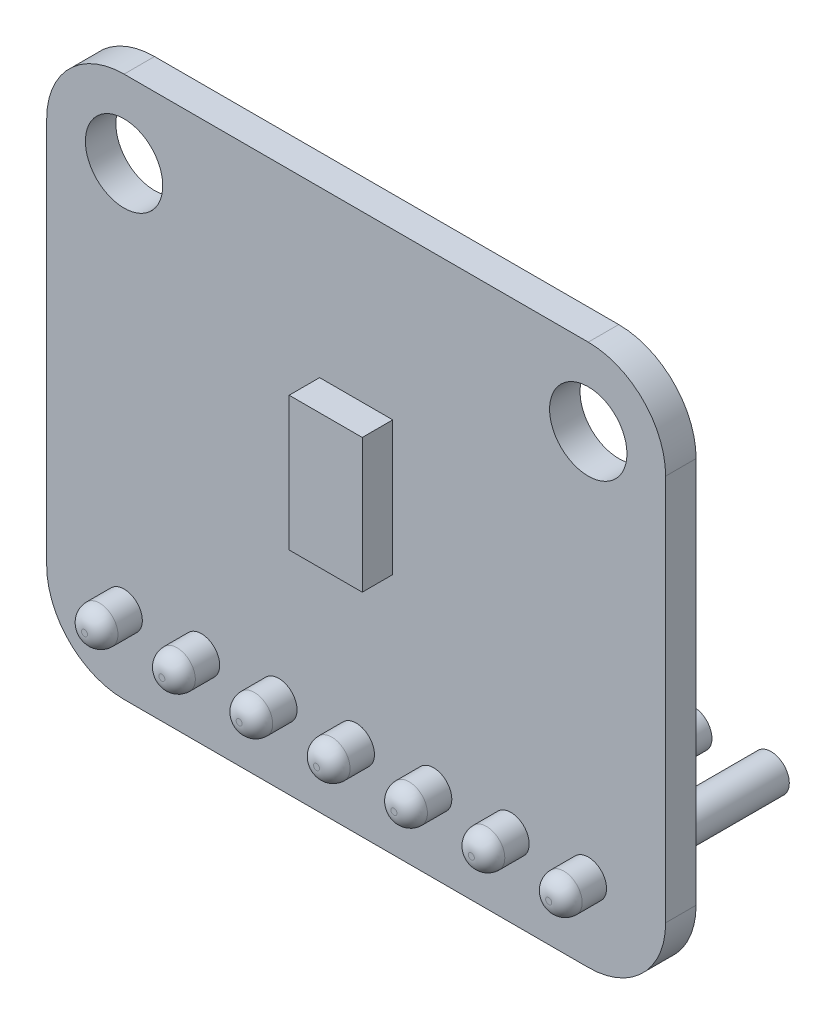
from build123d import *

# Parameters (mm, degrees)
SKETCH1_W           = 20.32
SKETCH1_H           = 17.78
BOSS_EXTRUDE1_DEPTH = 1
FILLET2_R           = 2.54
SKETCH2_R           = 1.27
CUT_EXTRUDE1_DEPTH  = 14.537270774
SKETCH3_W           = 2.4
SKETCH3_H           = 4.4
BOSS_EXTRUDE2_DEPTH = 1
SKETCH4_R           = 0.6
BOSS_EXTRUDE3_DEPTH = 1.3
BOSS_EXTRUDE4_START = -6
SKETCH4_2_R         = 0.6
BOSS_EXTRUDE4_DEPTH = 6
FILLET3_R           = 0.5


with BuildPart() as part:
    # Sketch1 → Boss-Extrude1 (new body)
    with BuildSketch(Plane.XY):
        Rectangle(SKETCH1_W, SKETCH1_H)
    extrude(amount=BOSS_EXTRUDE1_DEPTH)

    # Fillet2
    fillet2_edges = [part.edges().sort_by_distance(p)[0] for p in [
        (-10.16, -8.89, 0.5),
        (10.16, -8.89, 0.5),
        (10.16, 8.89, 0.5),
        (-10.16, 8.89, 0.5),
    ]]
    fillet(fillet2_edges, radius=FILLET2_R)

    # Sketch2 → Cut-Extrude1 (cut, through all)
    with BuildSketch(Plane.XY.offset(1)):
        with Locations((-7.62, 6.35)):
            Circle(SKETCH2_R)
        with Locations((7.62, 6.35)):
            Circle(SKETCH2_R)
    extrude(amount=-CUT_EXTRUDE1_DEPTH, mode=Mode.SUBTRACT)

    # Sketch3 → Boss-Extrude2 (add)
    with BuildSketch(Plane.XY.offset(1)):
        with Locations((0, 1.27)):
            Rectangle(SKETCH3_W, SKETCH3_H)
    extrude(amount=BOSS_EXTRUDE2_DEPTH)

    # Sketch4 → Boss-Extrude3 (add)
    with BuildSketch(Plane.XY.offset(1)):
        with Locations((-7.62, -6.35)):
            Circle(SKETCH4_R)
        with Locations((-5.08, -6.35)):
            Circle(SKETCH4_R)
        with Locations((-2.54, -6.35)):
            Circle(SKETCH4_R)
        with Locations((0, -6.35)):
            Circle(SKETCH4_R)
        with Locations((2.54, -6.35)):
            Circle(SKETCH4_R)
        with Locations((5.08, -6.35)):
            Circle(SKETCH4_R)
        with Locations((7.62, -6.35)):
            Circle(SKETCH4_R)
    extrude(amount=BOSS_EXTRUDE3_DEPTH)

    # Sketch4<2> → Boss-Extrude4 (add)
    with BuildSketch(Plane.XY.offset(1).offset(BOSS_EXTRUDE4_START)):
        with Locations((-7.62, -6.35)):
            Circle(SKETCH4_2_R)
        with Locations((-5.08, -6.35)):
            Circle(SKETCH4_2_R)
        with Locations((-2.54, -6.35)):
            Circle(SKETCH4_2_R)
        with Locations((0, -6.35)):
            Circle(SKETCH4_2_R)
        with Locations((2.54, -6.35)):
            Circle(SKETCH4_2_R)
        with Locations((5.08, -6.35)):
            Circle(SKETCH4_2_R)
        with Locations((7.62, -6.35)):
            Circle(SKETCH4_2_R)
    extrude(amount=BOSS_EXTRUDE4_DEPTH)

    # Fillet3
    fillet3_edges = [part.edges().sort_by_distance(p)[0] for p in [
        (1.94, -6.35, 2.3),
        (7.02, -6.35, 2.3),
        (4.48, -6.35, 2.3),
        (-0.6, -6.35, 2.3),
        (-3.14, -6.35, 2.3),
        (-5.68, -6.35, 2.3),
        (-8.22, -6.35, 2.3),
    ]]
    fillet(fillet3_edges, radius=FILLET3_R)


solid = part.part
